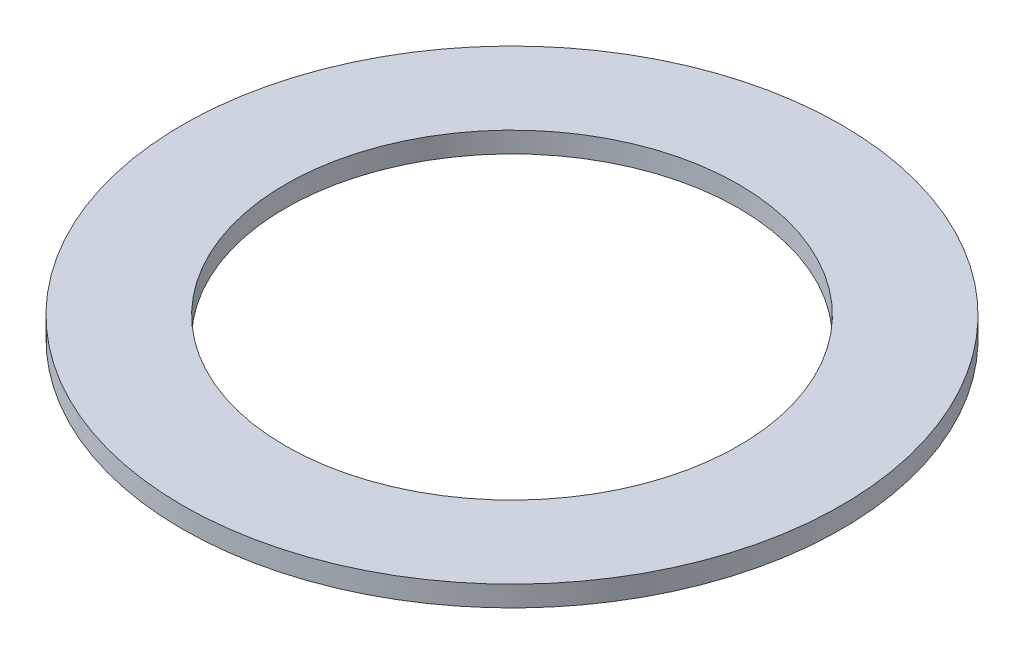
from build123d import *

# Parameters (mm, degrees)
SKETCH1_W = 15.875
SKETCH1_H = 3.175


with BuildPart() as part:
    # Sketch1 → Revolve1 (revolve)
    with BuildSketch(Plane.XY, mode=Mode.PRIVATE) as revolve1_sk:
        with Locations((42.8625, 1.5875)):
            Rectangle(SKETCH1_W, SKETCH1_H)
    revolve(revolve1_sk.sketch.rotate(Axis((0, 0, 0), (0, 1, 0)), 90), axis=Axis((0, 0, 0), (0, 1, 0)))


solid = part.part
